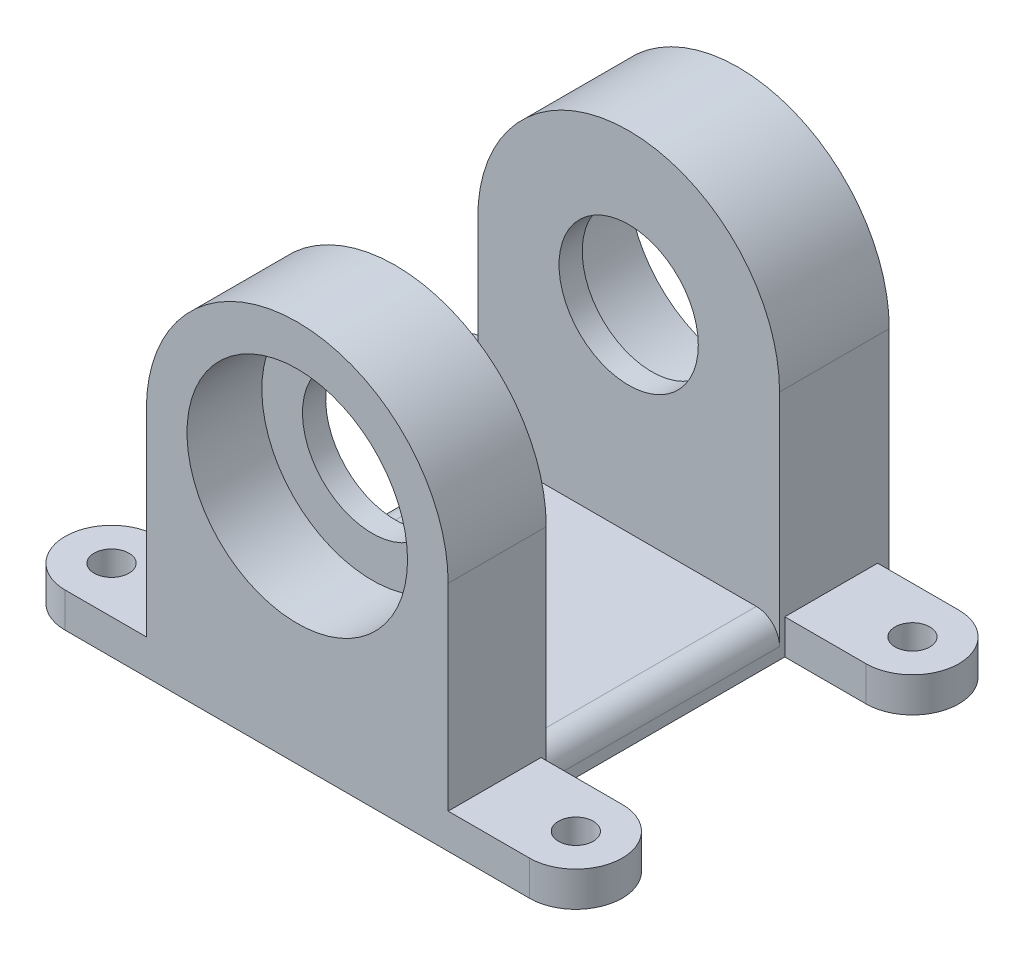
from build123d import *

# Parameters (mm, degrees)
CROQUIS1_R              = 9.5
SALIENTE_EXTRUIR1_DEPTH = 37
CROQUIS2_W              = 20.1
CROQUIS2_H              = 30
CORTAR_EXTRUIR2_DEPTH   = 50.44694126
CROQUIS3_R              = 9.5
CROQUIS3_R_2            = 6
SALIENTE_EXTRUIR2_DEPTH = 2
SALIENTE_EXTRUIR3_START = -2
CROQUIS4_R              = 9.5
CROQUIS4_R_2            = 6
SALIENTE_EXTRUIR3_DEPTH = 2
SALIENTE_EXTRUIR4_DEPTH = 3
CROQUIS6_R              = 1.5
CORTAR_EXTRUIR3_DEPTH   = 56.081757416
REDONDEO3_R             = 2
SALIENTE_EXTRUIR6_START = 1
CROQUIS9_R              = 9.5
SALIENTE_EXTRUIR6_DEPTH = 1


with BuildPart() as part:
    # Croquis1 → Saliente-Extruir1 (new body)
    with BuildSketch(Plane.XY):
        with BuildLine():
            Line((-13, 0), (-13, -20))
            Line((-13, -20), (13, -20))
            Line((13, -20), (13, 0))
            ThreePointArc((13, 0), (0, 13), (-13, 0))
        make_face()
        Circle(CROQUIS1_R, mode=Mode.SUBTRACT)
    extrude(amount=SALIENTE_EXTRUIR1_DEPTH)

    # Croquis2 → Cortar-Extruir2 (cut, through all)
    with BuildSketch(Plane(origin=(13, 0, 0), x_dir=(0, 0, -1), z_dir=(1, 0, 0))):
        with Locations((-18.5, -2)):
            Rectangle(CROQUIS2_W, CROQUIS2_H)
    extrude(amount=-CORTAR_EXTRUIR2_DEPTH, mode=Mode.SUBTRACT)

    # Croquis3 → Saliente-Extruir2 (add)
    with BuildSketch(Plane(origin=(0, 0, 28.55), x_dir=(-1, 0, 0), z_dir=(0, 0, -1))):
        with Locations(Location((0, 0, 0), (0, 0, 90))):
            Circle(CROQUIS3_R)
        with Locations(Location((0, 0, 0), (0, 0, 90))):
            Circle(CROQUIS3_R_2, mode=Mode.SUBTRACT)
    extrude(amount=-SALIENTE_EXTRUIR2_DEPTH)

    # Croquis4 → Saliente-Extruir3 (add)
    with BuildSketch(Plane.XY.offset(8.45).offset(SALIENTE_EXTRUIR3_START)):
        Circle(CROQUIS4_R)
        with Locations(Location((0, 0, 0), (0, 0, 90))):
            Circle(CROQUIS4_R_2, mode=Mode.SUBTRACT)
    extrude(amount=SALIENTE_EXTRUIR3_DEPTH)

    # Croquis5 → Saliente-Extruir4 (add)
    with BuildSketch(Plane.XZ.offset(20)):
        with BuildLine():
            Line((13, 37), (20, 37))
            ThreePointArc((20, 37), (24, 33), (20, 29))
            Line((20, 29), (13, 29))
            Line((13, 29), (13, 37))
        make_face()
        with BuildLine():
            Line((13, 0), (20, 0))
            ThreePointArc((20, 0), (24, 4), (20, 8))
            Line((20, 8), (13, 8))
            Line((13, 8), (13, 0))
        make_face()
        with BuildLine():
            Line((-13, 0), (-20, 0))
            ThreePointArc((-20, 0), (-24, 4), (-20, 8))
            Line((-20, 8), (-13, 8))
            Line((-13, 8), (-13, 0))
        make_face()
        with BuildLine():
            Line((-13, 29), (-13, 37))
            Line((-13, 37), (-20, 37))
            ThreePointArc((-20, 37), (-24, 33), (-20, 29))
            Line((-20, 29), (-13, 29))
        make_face()
    extrude(amount=-SALIENTE_EXTRUIR4_DEPTH)

    # Croquis6 → Cortar-Extruir3 (cut, through all)
    with BuildSketch(Plane.XZ.offset(20)):
        with Locations(Location((-20, 33, 0), (0, 0, 270))):
            Circle(CROQUIS6_R)
        with Locations(Location((20, 33, 0), (0, 0, 270))):
            Circle(CROQUIS6_R)
        with Locations(Location((-20, 4, 0), (0, 0, 270))):
            Circle(CROQUIS6_R)
        with Locations(Location((20, 4, 0), (0, 0, 270))):
            Circle(CROQUIS6_R)
    extrude(amount=-CORTAR_EXTRUIR3_DEPTH, mode=Mode.SUBTRACT)

    # Redondeo3
    redondeo3_edges = [part.edges().sort_by_distance(p)[0] for p in [
        (-13, -17, 18.5),
        (13, -17, 18.5),
    ]]
    fillet(redondeo3_edges, radius=REDONDEO3_R)

    # Croquis9 → Saliente-Extruir6 (add)
    with BuildSketch(Plane(origin=(0, 0, 0), x_dir=(-1, 0, 0), z_dir=(0, 0, -1)).offset(SALIENTE_EXTRUIR6_START)):
        with BuildLine():
            Line((-13, -17), (-13, 0))
            ThreePointArc((-13, 0), (0, 13), (13, 0))
            Line((13, 0), (13, -20))
            Line((13, -20), (-13, -20))
            Line((-13, -20), (-13, -17))
        make_face()
        Circle(CROQUIS9_R, mode=Mode.SUBTRACT)
    extrude(amount=-SALIENTE_EXTRUIR6_DEPTH)


solid = part.part
